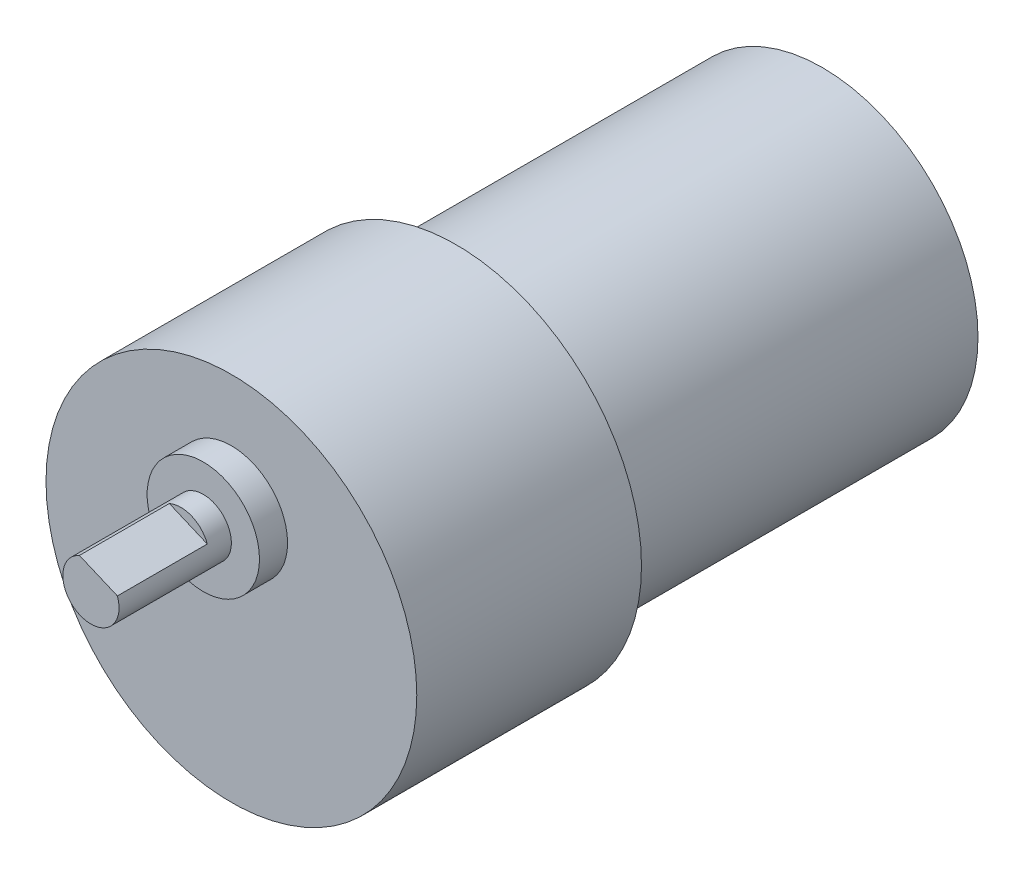
from build123d import *

# Parameters (mm, degrees)
SKETCH1_R           = 16.5
BOSS_EXTRUDE1_DEPTH = 20
SKETCH2_R           = 13.85
BOSS_EXTRUDE2_DEPTH = 32.6
SKETCH3_R           = 5
BOSS_EXTRUDE3_DEPTH = 2.2
SKETCH4_R           = 1.15
BOSS_EXTRUDE4_DEPTH = 3.3
SKETCH5_R           = 5
BOSS_EXTRUDE5_DEPTH = 2.5
SKETCH6_R           = 2.5
BOSS_EXTRUDE6_DEPTH = 10
CUT_EXTRUDE1_START  = -8
CUT_EXTRUDE1_DEPTH  = 8


with BuildPart() as part:
    # Sketch1 → Boss-Extrude1 (new body)
    with BuildSketch(Plane.XY):
        Circle(SKETCH1_R)
    extrude(amount=BOSS_EXTRUDE1_DEPTH)

    # Sketch2 → Boss-Extrude2 (add)
    with BuildSketch(Plane(origin=(0, 0, 0), x_dir=(-1, 0, 0), z_dir=(0, 0, -1))):
        Circle(SKETCH2_R)
    extrude(amount=BOSS_EXTRUDE2_DEPTH)

    # Sketch3 → Boss-Extrude3 (add)
    with BuildSketch(Plane(origin=(0, 0, -32.6), x_dir=(-1, 0, 0), z_dir=(0, 0, -1))):
        Circle(SKETCH3_R)
    extrude(amount=BOSS_EXTRUDE3_DEPTH)

    # Sketch4 → Boss-Extrude4 (add)
    with BuildSketch(Plane(origin=(0, 0, -34.8), x_dir=(-1, 0, 0), z_dir=(0, 0, -1))):
        Circle(SKETCH4_R)
    extrude(amount=BOSS_EXTRUDE4_DEPTH)

    # Sketch5 → Boss-Extrude5 (add)
    with BuildSketch(Plane.XY.offset(20)):
        with Locations((0, 6)):
            Circle(SKETCH5_R)
    extrude(amount=BOSS_EXTRUDE5_DEPTH)

    # Sketch6 → Boss-Extrude6 (add)
    with BuildSketch(Plane.XY.offset(22.5)):
        with Locations((0, 6)):
            Circle(SKETCH6_R)
    extrude(amount=BOSS_EXTRUDE6_DEPTH)

    # Sketch7 → Cut-Extrude1 (cut)
    with BuildSketch(Plane.XY.offset(32.5).offset(CUT_EXTRUDE1_START)):
        with BuildLine():
            Line((-1.024171461, 8.280586069), (2.352192857, 6.84686998))
            ThreePointArc((2.352192857, 6.84686998), (0.977136461, 8.301131099), (-1.024171461, 8.280586069))
        make_face()
    extrude(amount=CUT_EXTRUDE1_DEPTH, mode=Mode.SUBTRACT)


solid = part.part
